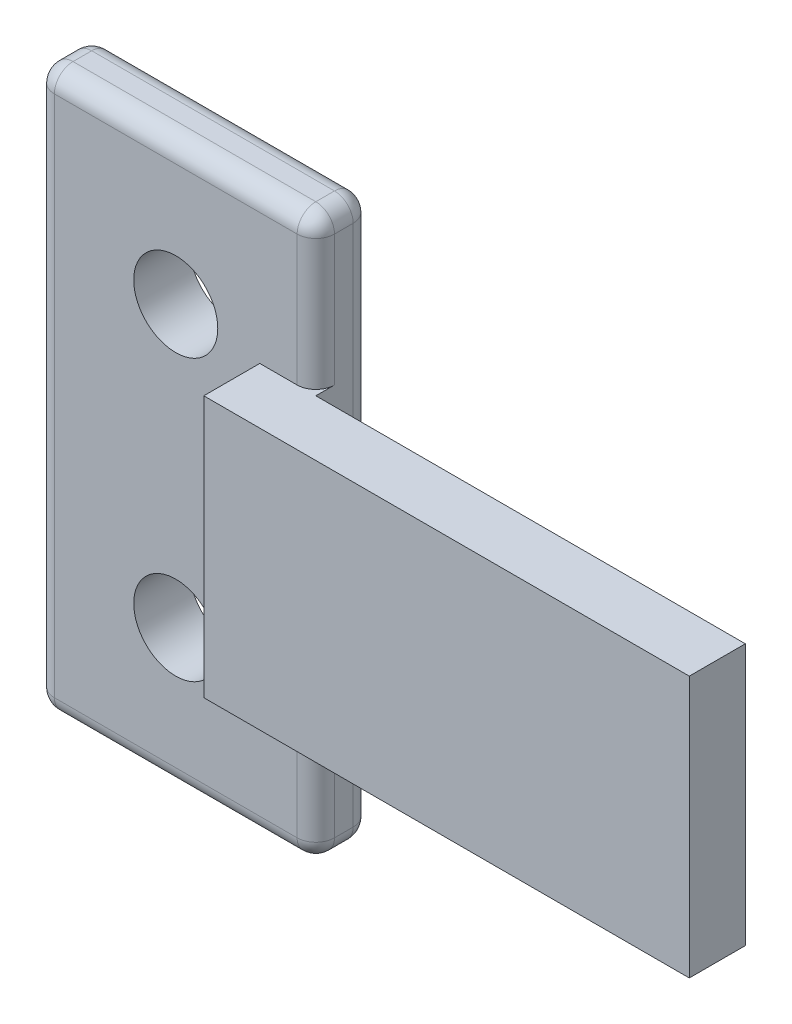
from build123d import *

# Parameters (mm, degrees)
SKETCH1_W           = 15
SKETCH1_H           = 30
SKETCH1_R           = 2.25
BOSS_EXTRUDE1_DEPTH = 3
SKETCH3_W           = 3
SKETCH3_H           = 14
BOSS_EXTRUDE2_DEPTH = 3
SKETCH4_W           = 3
SKETCH4_H           = 14
BOSS_EXTRUDE3_DEPTH = 26
FILLET2_R           = 1


with BuildPart() as part:
    # Sketch1 → Boss-Extrude1 (new body)
    with BuildSketch(Plane.XY):
        with Locations((7.5, -15)):
            Rectangle(SKETCH1_W, SKETCH1_H)
        with Locations((7.5, -7.5)):
            Circle(SKETCH1_R, mode=Mode.SUBTRACT)
        with Locations((7.5, -22.5)):
            Circle(SKETCH1_R, mode=Mode.SUBTRACT)
    extrude(amount=BOSS_EXTRUDE1_DEPTH)

    # Sketch3 → Boss-Extrude2 (add)
    with BuildSketch(Plane.ZY.offset(-15)):
        with Locations((4.5, -15)):
            Rectangle(SKETCH3_W, SKETCH3_H)
    extrude(amount=BOSS_EXTRUDE2_DEPTH)

    # Sketch4 → Boss-Extrude3 (add)
    with BuildSketch(Plane.ZY.offset(-12)):
        with Locations((4.5, -15)):
            Rectangle(SKETCH4_W, SKETCH4_H)
    extrude(amount=-BOSS_EXTRUDE3_DEPTH)

    # Fillet2
    fillet2_edges = [part.edges().sort_by_distance(p)[0] for p in [
        (7.5, -30, 3),
        (7.5, -30, 0),
        (7.5, 0, 0),
        (7.5, 0, 3),
        (0, 0, 1.5),
        (0, -15, 3),
        (0, -30, 1.5),
        (0, -15, 0),
        (15, -30, 1.5),
        (15, 0, 1.5),
        (15, -4, 3),
        (15, -26, 3),
        (15, -15, 0),
    ]]
    fillet(fillet2_edges, radius=FILLET2_R)


solid = part.part
